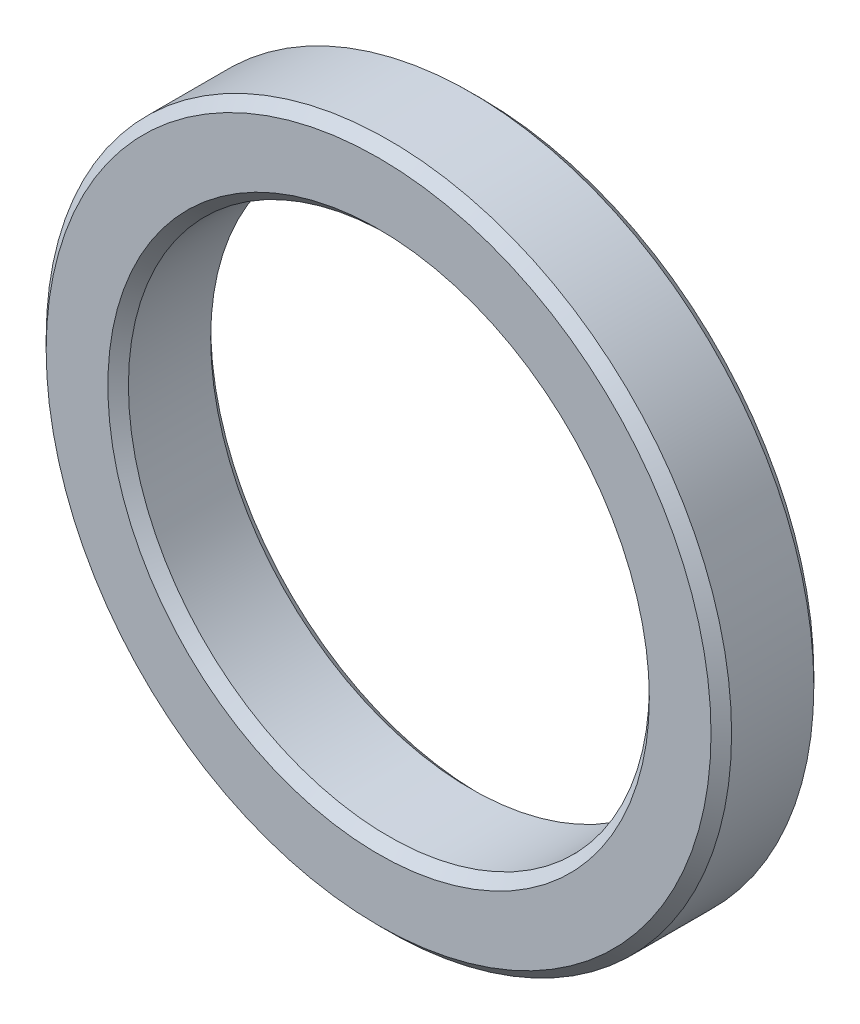
from build123d import *

# Parameters (mm, degrees)
SKETCH_1_R      = 10
SKETCH_1_R_2    = 7.6
EXTRUDE_1_DEPTH = 3
CHAMFER_1_SIZE  = 0.3


with BuildPart() as part:
    # 草图1 → 凸台-拉伸1 (new body)
    with BuildSketch(Plane.XY):
        Circle(SKETCH_1_R)
        Circle(SKETCH_1_R_2, mode=Mode.SUBTRACT)
    extrude(amount=EXTRUDE_1_DEPTH)

    # 倒角1
    chamfer_1_edges = [part.edges().sort_by_distance(p)[0] for p in [
        (-10, 0, 0),
        (-10, 0, 3),
        (-7.6, 0, 0),
        (-7.6, 0, 3),
    ]]
    chamfer(chamfer_1_edges, length=CHAMFER_1_SIZE)


solid = part.part
